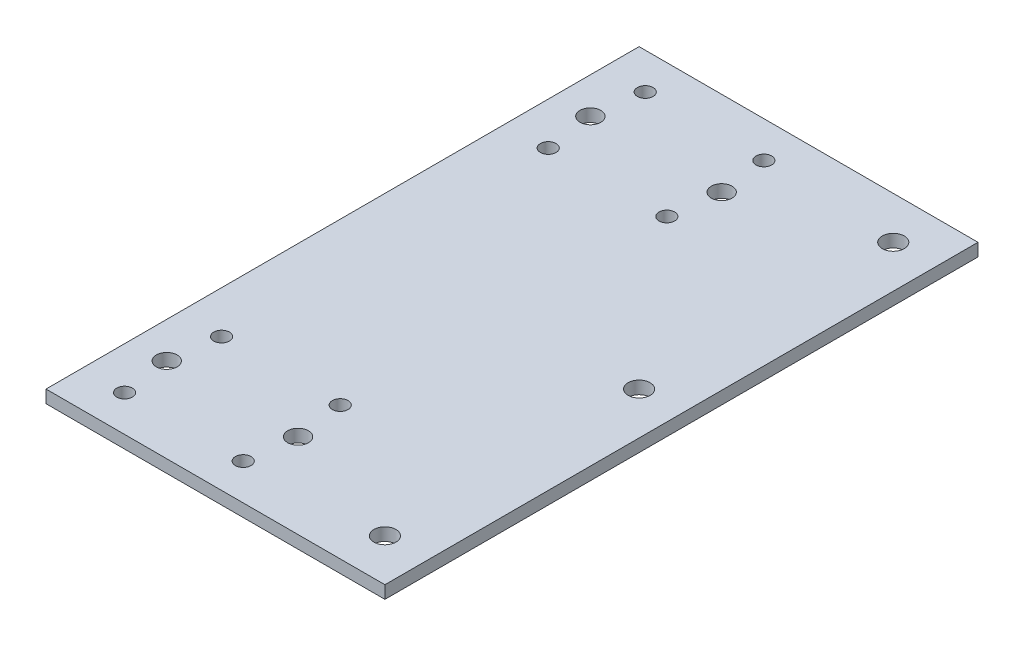
from build123d import *

# Parameters (mm, degrees)
SKETCH_1_R          = 2.5
SKETCH_1_R_2        = 2.45
SKETCH_1_R_3        = 1.85
SKETCH_1_W          = 48
SKETCH_1_H          = 40
EXTRUDE_1_DEPTH     = 3
SKETCH_2_R          = 2.6
CUT_EXTRUDE_1_DEPTH = 10


with BuildPart() as part:
    # 草图1 → 凸台-拉伸1 (new body)
    # profile 1 of 5: a face of its own
    with BuildSketch(Plane(origin=(0, 0, 0), x_dir=(1, 0, 0), z_dir=(0, 1, 0))):
        with BuildLine():
            Line((8, -30), (8, -70))
            Line((8, -70), (40, -70))
            Line((40, -70), (40, 60))
            Line((40, 60), (32.5, 60))
            ThreePointArc((32.5, 60), (28.232233047, 58.232233047), (30, 62.5))
            Line((30, 62.5), (30, 70))
            Line((30, 70), (8, 70))
            Line((8, 70), (8, 30))
            Line((8, 30), (-40, 30))
            Line((-40, 30), (-40, -30))
            Line((-40, -30), (8, -30))
        make_face()
        with Locations(Location((30, -60, 0), (0, 0, 270))):
            Circle(SKETCH_1_R, mode=Mode.SUBTRACT)
        with Locations(Location((30, 0, 0), (0, 0, 270))):
            Circle(SKETCH_1_R, mode=Mode.SUBTRACT)
    # profile 2 of 5: a face of its own
    with BuildSketch(Plane(origin=(0, 0, 0), x_dir=(1, 0, 0), z_dir=(0, 1, 0))):
        with BuildLine():
            Line((32.5, 60), (40, 60))
            Line((40, 60), (40, 70))
            Line((40, 70), (30, 70))
            Line((30, 70), (30, 62.5))
            ThreePointArc((30, 62.5), (31.767766953, 61.767766953), (32.5, 60))
        make_face()
    # profile 3 of 5: a face of its own
    with BuildSketch(Plane(origin=(0, 0, 0), x_dir=(1, 0, 0), z_dir=(0, 1, 0))):
        with BuildLine():
            Line((-40, 61.45), (-40, 30))
            Line((-40, 30), (8, 30))
            Line((8, 30), (8, 70))
            Line((8, 70), (-30, 70))
            Line((-30, 70), (-30, 63.3))
            ThreePointArc((-30, 63.3), (-28.691852455, 62.758147545), (-28.15, 61.45))
            ThreePointArc((-28.15, 61.45), (-30, 59.6), (-31.85, 61.45))
            Line((-31.85, 61.45), (-40, 61.45))
        make_face()
        with Locations(Location((-31.5, 50, 0), (0, 0, 270))):
            Circle(SKETCH_1_R_2, mode=Mode.SUBTRACT)
        with Locations(Location((-30, 38.55, 0), (0, 0, 270))):
            Circle(SKETCH_1_R_3, mode=Mode.SUBTRACT)
        with Locations(Location((-2, 38.55, 0), (0, 0, 270))):
            Circle(SKETCH_1_R_3, mode=Mode.SUBTRACT)
        with Locations(Location((-0.5, 50, 0), (0, 0, 270))):
            Circle(SKETCH_1_R_2, mode=Mode.SUBTRACT)
        with Locations(Location((-2, 61.45, 0), (0, 0, 270))):
            Circle(SKETCH_1_R_3, mode=Mode.SUBTRACT)
    # profile 4 of 5: a face of its own
    with BuildSketch(Plane(origin=(0, 0, 0), x_dir=(1, 0, 0), z_dir=(0, 1, 0))):
        with BuildLine():
            Line((-40, 70), (-40, 61.45))
            Line((-40, 61.45), (-31.85, 61.45))
            ThreePointArc((-31.85, 61.45), (-31.308147545, 62.758147545), (-30, 63.3))
            Line((-30, 63.3), (-30, 70))
            Line((-30, 70), (-40, 70))
        make_face()
    # profile 5 of 5: a face of its own
    with BuildSketch(Plane(origin=(0, 0, 0), x_dir=(1, 0, 0), z_dir=(0, 1, 0))):
        with Locations((-16, -50)):
            Rectangle(SKETCH_1_W, SKETCH_1_H)
        with Locations(Location((-30, -61.45, 0), (0, 0, 270))):
            Circle(SKETCH_1_R_3, mode=Mode.SUBTRACT)
        with Locations(Location((-31.5, -50, 0), (0, 0, 270))):
            Circle(SKETCH_1_R_2, mode=Mode.SUBTRACT)
        with Locations(Location((-30, -38.55, 0), (0, 0, 270))):
            Circle(SKETCH_1_R_3, mode=Mode.SUBTRACT)
        with Locations(Location((-2, -61.45, 0), (0, 0, 270))):
            Circle(SKETCH_1_R_3, mode=Mode.SUBTRACT)
        with Locations(Location((-0.5, -50, 0), (0, 0, 270))):
            Circle(SKETCH_1_R_2, mode=Mode.SUBTRACT)
        with Locations(Location((-2, -38.55, 0), (0, 0, 270))):
            Circle(SKETCH_1_R_3, mode=Mode.SUBTRACT)
    extrude(amount=EXTRUDE_1_DEPTH)

    # 草图2 → 切除-拉伸1 (cut)
    with BuildSketch(Plane(origin=(0, 3, 0), x_dir=(1, 0, 0), z_dir=(0, 1, 0))):
        with Locations(Location((30, 60, 0), (0, 0, 270))):
            Circle(SKETCH_2_R)
        with Locations(Location((30, 0, 0), (0, 0, 270))):
            Circle(SKETCH_2_R)
        with Locations(Location((30, -60, 0), (0, 0, 270))):
            Circle(SKETCH_2_R)
    extrude(amount=-CUT_EXTRUDE_1_DEPTH, mode=Mode.SUBTRACT)


solid = part.part
